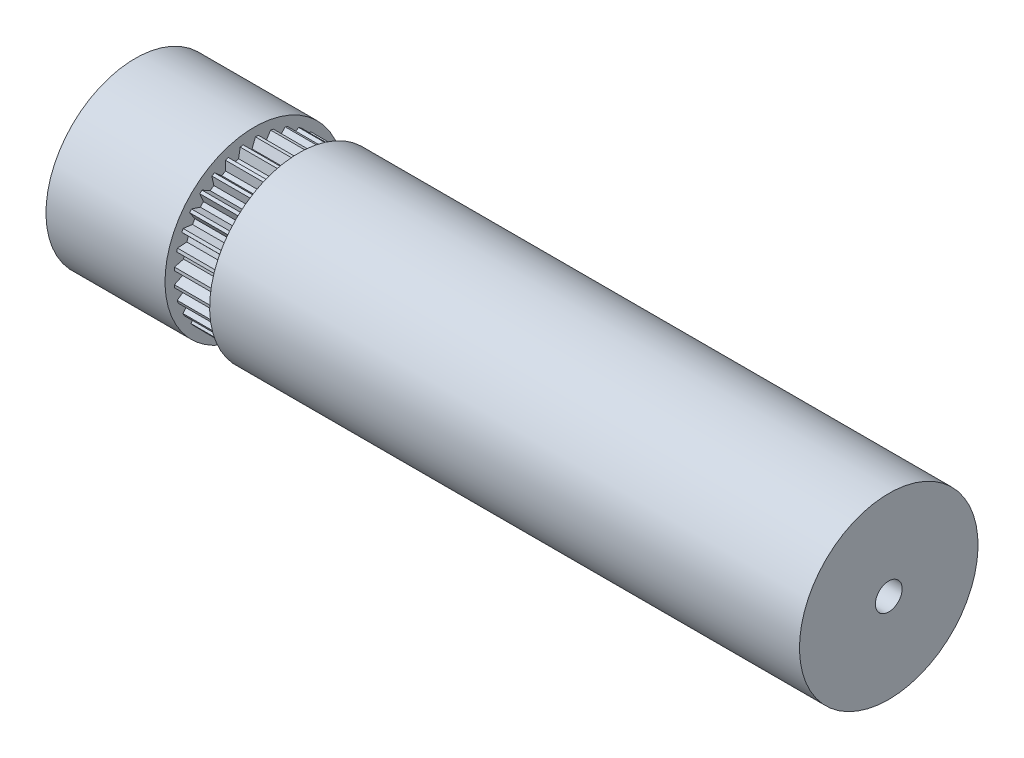
from build123d import *

# Parameters (mm, degrees)
BOSS_EXTRU_1_DEPTH           = 7.5
R_P_TITION_CIRCULAIRE1_COUNT = 33
ENL_V_MAT_EXTRU_3_DEPTH      = 129.364948487
ENL_V_MAT_EXTRU_3_DEPTH_BACK = 129.364948487
ESQUISSE7_R                  = 2.25


with BuildPart() as part:
    # Esquisse1 → Révolution1 (revolve)
    with BuildSketch(Plane.XY, mode=Mode.PRIVATE) as r_volution1_sk:
        Polygon((-63.3, 15), (-63.3, 0), (63.3, 0), (63.3, 15), (-35.8, 15), (-35.8, 12), (-43.3, 12), (-43.3, 15), align=None)
    revolve(r_volution1_sk.sketch.rotate(Axis((-63.3, 0, 0), (1, 0, 0)), 180), axis=Axis((-63.3, 0, 0), (1, 0, 0)))

    # Esquisse3 → Boss.-Extru.1 (add)
    with BuildSketch(Plane(origin=(-43.3, 0, 0), x_dir=(0, 0, -1), z_dir=(1, 0, 0))):
        Polygon((0.691111458, 13.454530338), (1.369204766, 11.251751142), (-0.629722527, 11.317246794), (0.191111458, 13.470913037), align=None)
    boss_extru_1 = extrude(amount=BOSS_EXTRU_1_DEPTH)

    # Répétition circulaire1: Boss.-Extru.1 ×33 about axis
    r_p_tition_circulaire1_axis = Axis((0, 0, 0), (1, 0, 0))
    for i in range(1, R_P_TITION_CIRCULAIRE1_COUNT):
        add(boss_extru_1.rotate(r_p_tition_circulaire1_axis, i * 360 / R_P_TITION_CIRCULAIRE1_COUNT))

    # Esquisse7 → Enlèv. mat.-Extru.3 (cut, two sides: drawn at the far end of the back side and taken through both)
    with BuildSketch(Plane.ZY.offset(63.3).offset(-ENL_V_MAT_EXTRU_3_DEPTH_BACK)):
        with Locations(Location((0, 0, 0), (0, 0, 90))):
            Circle(ESQUISSE7_R)
    extrude(amount=ENL_V_MAT_EXTRU_3_DEPTH + ENL_V_MAT_EXTRU_3_DEPTH_BACK, mode=Mode.SUBTRACT)


solid = part.part
